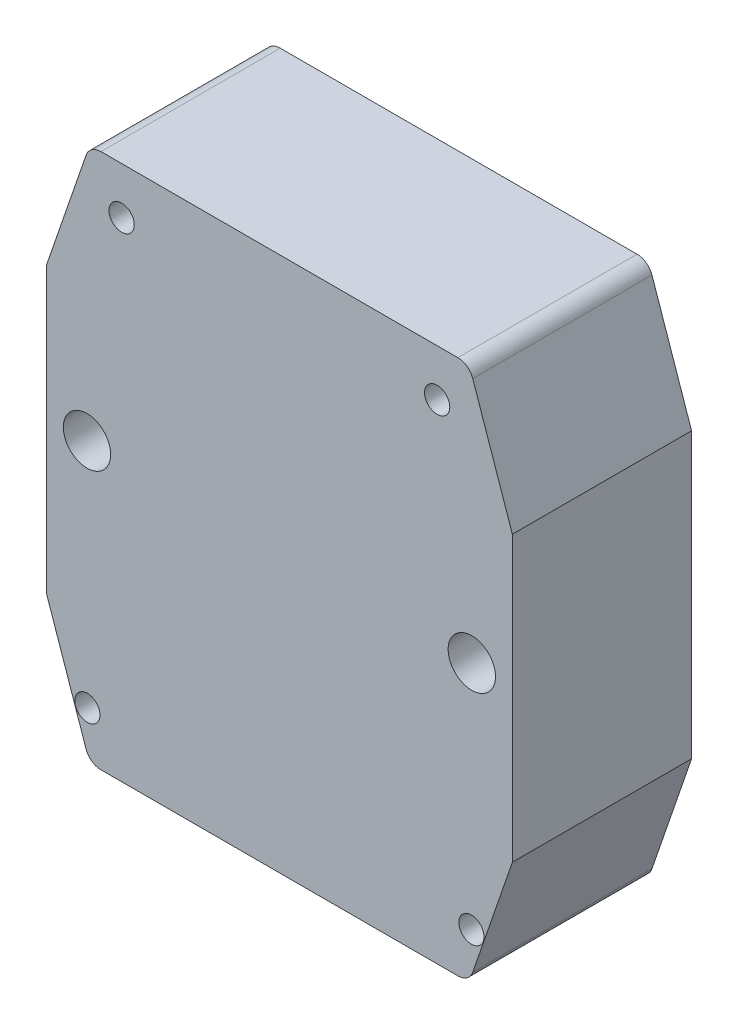
from build123d import *

# Parameters (mm, degrees)
SKETCH1_R           = 2.54
SKETCH1_R_2         = 4.7625
BOSS_EXTRUDE1_DEPTH = 36.068


with BuildPart() as part:
    # Sketch1 → Boss-Extrude1 (new body)
    with BuildSketch(Plane.XY):
        with BuildLine():
            Line((65.395995047, 51.923287663), (57.425031933, 75.072645444))
            ThreePointArc((57.425031933, 75.072645444), (56.26674234, 76.623783324), (54.423010456, 77.213966553))
            Line((54.423010456, 77.213966553), (-17.406388387, 77.213966553))
            ThreePointArc((-17.406388387, 77.213966553), (-19.250120272, 76.623783324), (-20.408409865, 75.072645444))
            Line((-20.408409865, 75.072645444), (-28.379372979, 51.923287663))
            Line((-28.379372979, 51.923287663), (-28.379372979, -5.244694556))
            Line((-28.379372979, -5.244694556), (-20.408409865, -28.394052337))
            ThreePointArc((-20.408409865, -28.394052337), (-19.250120272, -29.945190218), (-17.406388387, -30.535373447))
            Line((-17.406388387, -30.535373447), (54.423010456, -30.535373447))
            ThreePointArc((54.423010456, -30.535373447), (56.26674234, -29.945190218), (57.425031933, -28.394052337))
            Line((57.425031933, -28.394052337), (65.395995047, -5.244694556))
            Line((65.395995047, -5.244694556), (65.395995047, 51.923287663))
        make_face()
        with Locations((-13.241688966, 67.785486553)):
            Circle(SKETCH1_R, mode=Mode.SUBTRACT)
        with Locations((50.258311034, 67.785486553)):
            Circle(SKETCH1_R, mode=Mode.SUBTRACT)
        with Locations((-20.137788966, -21.106893447)):
            Circle(SKETCH1_R, mode=Mode.SUBTRACT)
        with Locations((57.154411034, -21.106893447)):
            Circle(SKETCH1_R, mode=Mode.SUBTRACT)
        with Locations((-20.215986176, 25.397966553)):
            Circle(SKETCH1_R_2, mode=Mode.SUBTRACT)
        with Locations((57.232608244, 25.397966553)):
            Circle(SKETCH1_R_2, mode=Mode.SUBTRACT)
    extrude(amount=BOSS_EXTRUDE1_DEPTH)


solid = part.part
